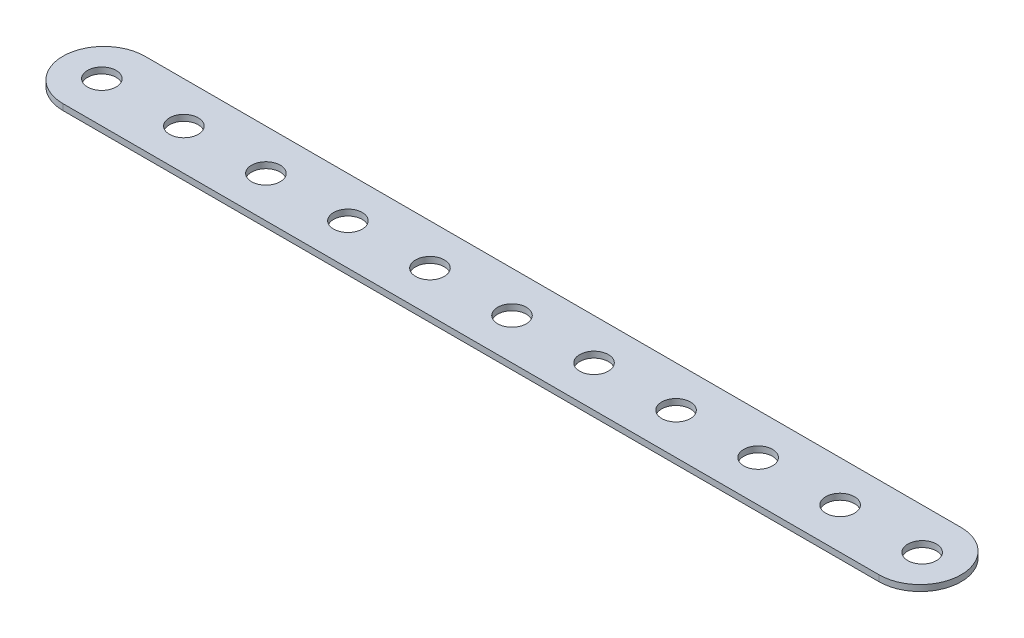
from build123d import *

# Parameters (mm, degrees)
SKETCH1_R                = 2.2225
BAR_DEPTH                = 0.9398
SKETCH2_R                = 2.2225
CENTER_HOLE_DEPTH        = 133.870150708
OTHER_CENTER_HOLES_COUNT = 9
OTHER_CENTER_HOLES_PITCH = 12.7


with BuildPart() as part:
    # Sketch1 → Bar (new body)
    with BuildSketch(Plane(origin=(0, 0, 0), x_dir=(-1, 0, 0), z_dir=(0, 1, 0))):
        with BuildLine():
            Line((126.365, 6.35), (0, 6.35))
            ThreePointArc((0, 6.35), (-6.35, 0), (0, -6.35))
            Line((0, -6.35), (126.365, -6.35))
            ThreePointArc((126.365, -6.35), (132.715, 0), (126.365, 6.35))
        make_face()
        with Locations(Location((126.6825, 0, 0), (0, 0, 90))):
            Circle(SKETCH1_R, mode=Mode.SUBTRACT)
        with Locations(Location((-0.3175, 0, 0), (0, 0, 90))):
            Circle(SKETCH1_R, mode=Mode.SUBTRACT)
    extrude(amount=BAR_DEPTH)

    # Sketch2 → Center Hole (cut, through all)
    with BuildSketch(Plane(origin=(0, 0.9398, 0), x_dir=(1, 0, 0), z_dir=(0, 1, 0))):
        with Locations(Location((-113.9825, 0, 0), (0, 0, 270))):
            Circle(SKETCH2_R)
    center_hole = extrude(amount=-CENTER_HOLE_DEPTH, mode=Mode.SUBTRACT)

    # Other Center Holes: Center Hole ×9
    with Locations(*[(i * OTHER_CENTER_HOLES_PITCH, 0, 0) for i in range(1, OTHER_CENTER_HOLES_COUNT)]):
        add(center_hole, mode=Mode.SUBTRACT)


solid = part.part
